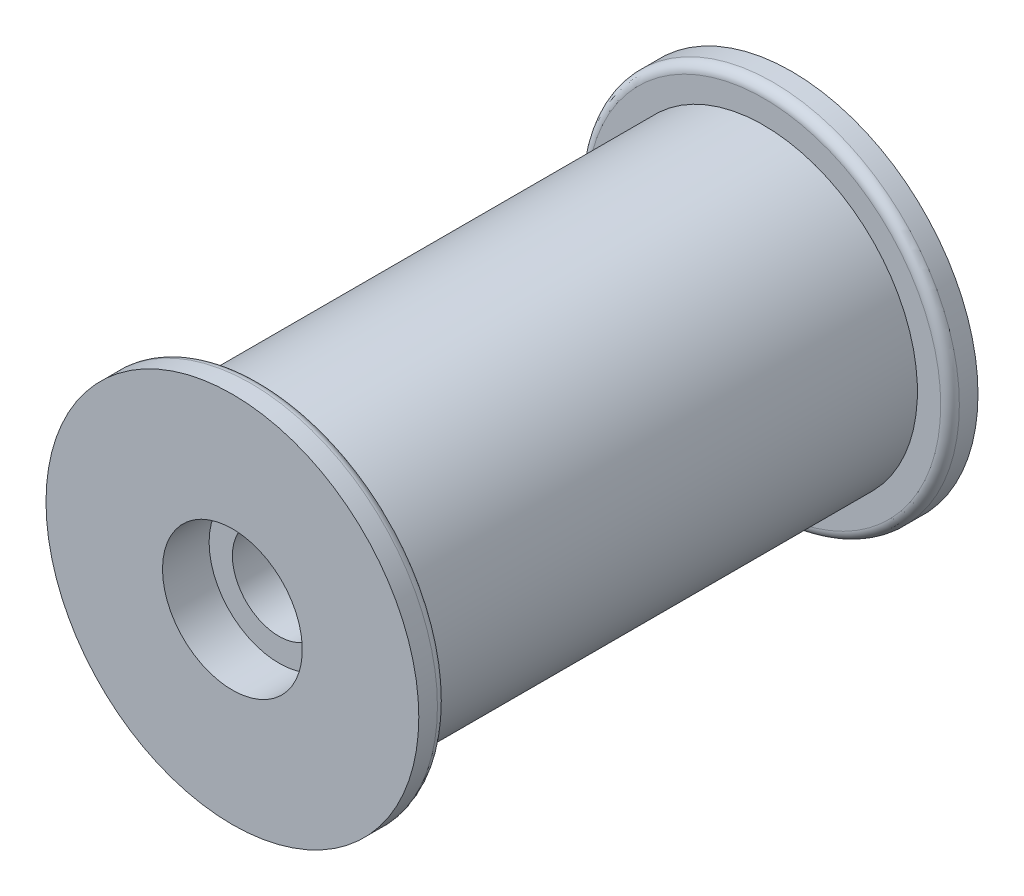
from build123d import *

# Parameters (mm, degrees)
FILLET_2_R = 1


with BuildPart() as part:
    # 草图1 → 旋转1 (revolve)
    with BuildSketch(Plane(origin=(0, 0, 0), x_dir=(1, 0, 0), z_dir=(0, 1, 0)), mode=Mode.PRIVATE) as revolve_1_sk:
        Polygon((7.5, -55), (7.5, -60), (20, -60), (20, -57), (16.5, -57), (16.5, -3), (20, -3), (20, 0), (7.5, 0), (7.5, -5), (5, -5), (5, -55), align=None)
    revolve(revolve_1_sk.sketch.rotate(Axis((0, 0, 0), (0, 0, 1)), 180), axis=Axis((0, 0, 0), (0, 0, 1)))

    # 圆角2
    fillet_2_edges = [part.edges().sort_by_distance(p)[0] for p in [
        (20, 0, 3),
        (20, 0, 57),
    ]]
    fillet(fillet_2_edges, radius=FILLET_2_R)


solid = part.part
